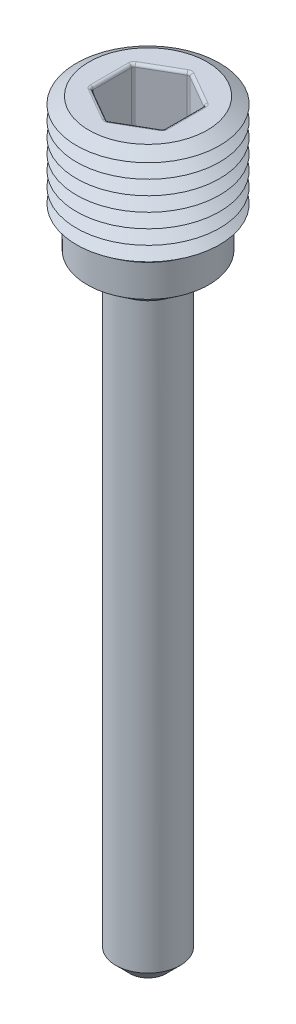
from build123d import *

# Parameters (mm, degrees)
CHAMFER1_SIZE      = 1
CHAMFER2_SIZE      = 0.5
CUT_EXTRUDE1_DEPTH = 7
FILLET1_R          = 0.2


with BuildPart() as part:
    # Sketch1 → Revolve1 (revolve)
    with BuildSketch(Plane.XY):
        Polygon((0, 0), (-2.25, 0), (-2.25, 41.7), (-4.25, 43.2), (-4.25, 45.5), (-5, 45.5), (-5, 52.5), (0, 52.5), align=None)
    revolve(axis=Axis((0, 52.5, 0), (0, -1, 0)))

    # Chamfer1
    chamfer1_edges = [part.edges().sort_by_distance(p)[0] for p in [
        (2.25, 0, 0),
    ]]
    chamfer(chamfer1_edges, length=CHAMFER1_SIZE)

    # Chamfer2
    chamfer2_edges = [part.edges().sort_by_distance(p)[0] for p in [
        (5, 52.5, 0),
    ]]
    chamfer(chamfer2_edges, length=CHAMFER2_SIZE)

    # Sketch2 → Cut-Extrude1 (cut)
    with BuildSketch(Plane(origin=(0, 52.5, 0), x_dir=(1, 0, 0), z_dir=(0, 1, 0))):
        Polygon((0, -2.886751346), (2.5, -1.443375673), (2.5, 1.443375673), (0, 2.886751346), (-2.5, 1.443375673), (-2.5, -1.443375673), align=None)
    extrude(amount=-CUT_EXTRUDE1_DEPTH, mode=Mode.SUBTRACT)

    # Fillet1
    fillet1_edges = [part.edges().sort_by_distance(p)[0] for p in [
        (-1.25, 45.5, 2.165063509),
        (0, 49, 2.886751346),
        (-2.5, 45.5, 0),
        (-2.5, 49, 1.443375673),
        (-1.25, 45.5, -2.165063509),
        (-2.5, 49, -1.443375673),
        (1.25, 45.5, -2.165063509),
        (0, 49, -2.886751346),
        (2.5, 45.5, 0),
        (2.5, 49, -1.443375673),
        (1.25, 45.5, 2.165063509),
        (2.5, 49, 1.443375673),
        (-1.25, 52.5, 2.165063509),
        (1.25, 52.5, 2.165063509),
        (2.5, 52.5, 0),
        (1.25, 52.5, -2.165063509),
        (-1.25, 52.5, -2.165063509),
        (-2.5, 52.5, 0),
    ]]
    fillet(fillet1_edges, radius=FILLET1_R)

    # Sketch3 → Cut-Revolve1 (revolve, cut)
    with BuildSketch(Plane.XY, mode=Mode.PRIVATE) as cut_revolve1_sk:
        Polygon((5, 52), (4.133974596, 51.5), (5, 51), align=None)
        Polygon((5, 51), (4.133974596, 50.5), (5, 50), align=None)
        Polygon((5, 50), (4.133974596, 49.5), (5, 49), align=None)
        Polygon((5, 49), (4.133974596, 48.5), (5, 48), align=None)
        Polygon((5, 48), (4.133974596, 47.5), (5, 47), align=None)
        Polygon((5, 47), (4.133974596, 46.5), (5, 46), align=None)
        Polygon((5, 46), (4.133974596, 45.5), (5, 45), align=None)
        Polygon((5, 53), (4.133974596, 52.5), (5, 52), align=None)
    revolve(cut_revolve1_sk.sketch.rotate(Axis((0, 53.547255409, 0), (0, 1, 0)), 90), axis=Axis((0, 53.547255409, 0), (0, 1, 0)), mode=Mode.SUBTRACT)


solid = part.part
